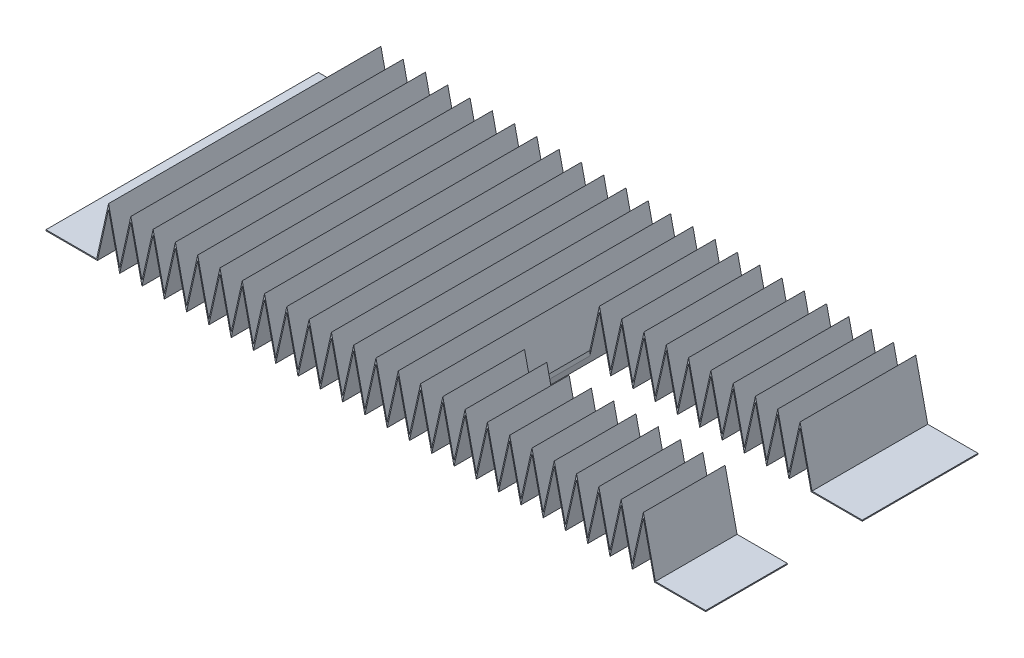
from build123d import *

# Parameters (mm, degrees)
EXTRUDE_THIN1_DEPTH     = 40
CUT_EXTRUDE4_DEPTH      = 184.782045388
CUT_EXTRUDE4_DEPTH_BACK = 184.782045388
SKETCH2_W               = 80
SKETCH2_H               = 22


with BuildPart() as part:
    # Sketch1 → Extrude-Thin1 (new, symmetric)
    with BuildSketch(Plane.XY):
        Polygon((-15.1, 0), (0, 0), (3.273, 14.741013228), (6.546, 0), (9.819, 14.741013228), (13.092, 0), (16.365, 14.741013228), (19.638, 0), (22.911, 14.741013228), (26.184, 0), (29.457, 14.741013228), (32.73, 0), (36.003, 14.741013228), (39.276, 0), (42.549, 14.741013228), (45.822, 0), (49.095, 14.741013228), (52.368, 0), (55.641, 14.741013228), (58.914, 0), (62.187, 14.741013228), (65.46, 0), (68.733, 14.741013228), (72.006, 0), (75.279, 14.741013228), (78.552, 0), (81.825, 14.741013228), (85.098, 0), (88.371, 14.741013228), (91.644, 0), (94.917, 14.741013228), (98.19, 0), (101.463, 14.741013228), (104.736, 0), (108.009, 14.741013228), (111.282, 0), (114.555, 14.741013228), (117.828, 0), (121.101, 14.741013228), (124.374, 0), (127.647, 14.741013228), (130.92, 0), (134.193, 14.741013228), (137.466, 0), (140.739, 14.741013228), (144.012, 0), (147.285, 14.741013228), (150.558, 0), (153.831, 14.741013228), (157.104, 0), (160.377, 14.741013228), (163.65, 0), (178.65, 0), (178.65, 0.3), (163.890695802, 0.3), (160.377, 16.125064557), (157.104, 1.384051329), (153.831, 16.125064557), (150.558, 1.384051329), (147.285, 16.125064557), (144.012, 1.384051329), (140.739, 16.125064557), (137.466, 1.384051329), (134.193, 16.125064557), (130.92, 1.384051329), (127.647, 16.125064557), (124.374, 1.384051329), (121.101, 16.125064557), (117.828, 1.384051329), (114.555, 16.125064557), (111.282, 1.384051329), (108.009, 16.125064557), (104.736, 1.384051329), (101.463, 16.125064557), (98.19, 1.384051329), (94.917, 16.125064557), (91.644, 1.384051329), (88.371, 16.125064557), (85.098, 1.384051329), (81.825, 16.125064557), (78.552, 1.384051329), (75.279, 16.125064557), (72.006, 1.384051329), (68.733, 16.125064557), (65.46, 1.384051329), (62.187, 16.125064557), (58.914, 1.384051329), (55.641, 16.125064557), (52.368, 1.384051329), (49.095, 16.125064557), (45.822, 1.384051329), (42.549, 16.125064557), (39.276, 1.384051329), (36.003, 16.125064557), (32.73, 1.384051329), (29.457, 16.125064557), (26.184, 1.384051329), (22.911, 16.125064557), (19.638, 1.384051329), (16.365, 16.125064557), (13.092, 1.384051329), (9.819, 16.125064557), (6.546, 1.384051329), (3.273, 16.125064557), (-0.240695802, 0.3), (-15.1, 0.3), align=None)
    extrude(amount=EXTRUDE_THIN1_DEPTH, both=True)

    # Sketch2 → Cut-Extrude4 (cut, two sides: drawn at the far end of the back side and taken through both)
    with BuildSketch(Plane(origin=(0, 0, 0), x_dir=(1, 0, 0), z_dir=(0, 1, 0)).offset(-CUT_EXTRUDE4_DEPTH_BACK)):
        with Locations((138.65, -5)):
            Rectangle(SKETCH2_W, SKETCH2_H)
    extrude(amount=CUT_EXTRUDE4_DEPTH + CUT_EXTRUDE4_DEPTH_BACK, mode=Mode.SUBTRACT)


solid = part.part
